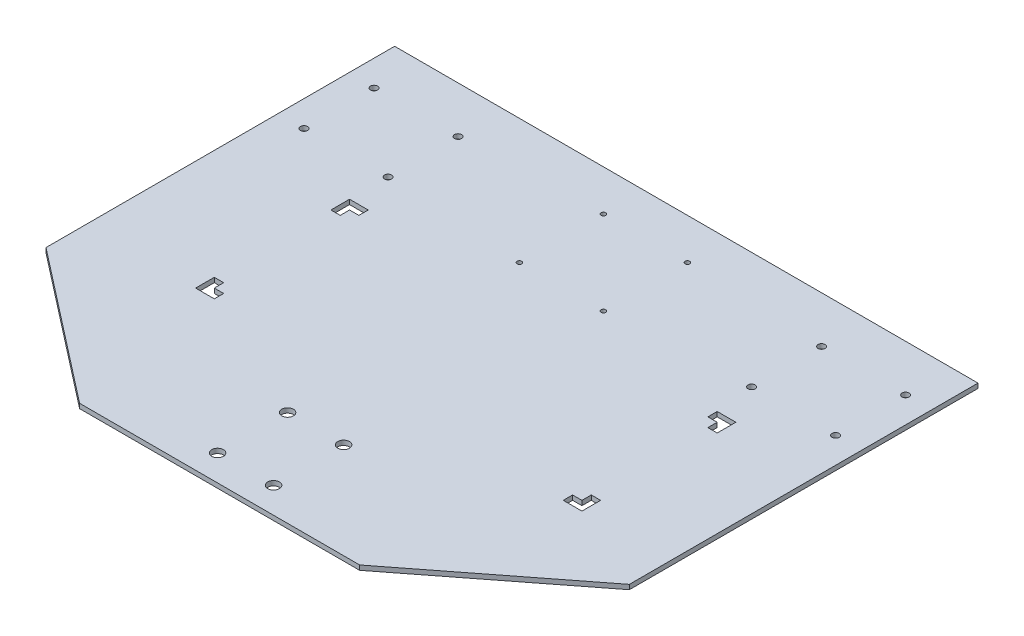
from build123d import *

# Parameters (mm, degrees)
SKETCH1_R           = 1.5
SKETCH1_R_2         = 1
SKETCH1_R_3         = 2.5
BOSS_EXTRUDE1_DEPTH = 2


with BuildPart() as part:
    # Sketch1 → Boss-Extrude1 (new body)
    with BuildSketch(Plane(origin=(0, 0, 0), x_dir=(1, 0, 0), z_dir=(0, 1, 0))):
        Polygon((-125, -50), (-60, -100.598017019), (60, -100.598017019), (125, -50), (125, 99.401982981), (-125, 99.401982981), align=None)
        with Locations(Location((-77.896249371, 49.467404951, 0), (0, 0, 270))):
            Circle(SKETCH1_R, mode=Mode.SUBTRACT)
        with Locations(Location((-77.896249371, 79.467404951, 0), (0, 0, 270))):
            Circle(SKETCH1_R, mode=Mode.SUBTRACT)
        with Locations(Location((-113.896249371, 79.467404951, 0), (0, 0, 270))):
            Circle(SKETCH1_R, mode=Mode.SUBTRACT)
        with Locations(Location((-113.896249371, 49.467404951, 0), (0, 0, 270))):
            Circle(SKETCH1_R, mode=Mode.SUBTRACT)
        with Locations(Location((113.896249371, 49.467404951, 0), (0, 0, 270))):
            Circle(SKETCH1_R, mode=Mode.SUBTRACT)
        with Locations(Location((113.896249371, 79.467404951, 0), (0, 0, 270))):
            Circle(SKETCH1_R, mode=Mode.SUBTRACT)
        with Locations(Location((77.896249371, 79.467404951, 0), (0, 0, 270))):
            Circle(SKETCH1_R, mode=Mode.SUBTRACT)
        with Locations(Location((77.896249371, 49.467404951, 0), (0, 0, 270))):
            Circle(SKETCH1_R, mode=Mode.SUBTRACT)
        with Locations(Location((-18, 81.850418852, 0), (0, 0, 270))):
            Circle(SKETCH1_R_2, mode=Mode.SUBTRACT)
        with Locations(Location((-18, 45.850418852, 0), (0, 0, 270))):
            Circle(SKETCH1_R_2, mode=Mode.SUBTRACT)
        with Locations(Location((18, 81.850418852, 0), (0, 0, 270))):
            Circle(SKETCH1_R_2, mode=Mode.SUBTRACT)
        with Locations(Location((18, 45.850418852, 0), (0, 0, 270))):
            Circle(SKETCH1_R_2, mode=Mode.SUBTRACT)
        with Locations(Location((-12, -59.472750438, 0), (0, 0, 270))):
            Circle(SKETCH1_R_3, mode=Mode.SUBTRACT)
        with Locations(Location((12, -59.472750438, 0), (0, 0, 270))):
            Circle(SKETCH1_R_3, mode=Mode.SUBTRACT)
        with Locations(Location((12, -89.472750438, 0), (0, 0, 270))):
            Circle(SKETCH1_R_3, mode=Mode.SUBTRACT)
        with Locations(Location((-12, -89.472750438, 0), (0, 0, 270))):
            Circle(SKETCH1_R_3, mode=Mode.SUBTRACT)
        Polygon((-69.896249371, 32.980170885), (-69.896249371, 28.980170885), (-73.896249371, 28.980170885), (-73.896249371, 24.980170885), (-77.896249371, 24.980170885), (-77.896249371, 32.980170885), align=None, mode=Mode.SUBTRACT)
        Polygon((-77.896249371, -24.980170885), (-77.896249371, -32.980170885), (-69.896249371, -32.980170885), (-69.896249371, -28.980170885), (-73.896249371, -28.980170885), (-73.896249371, -24.980170885), align=None, mode=Mode.SUBTRACT)
        Polygon((79.650184211, 32.980170885), (87.650184211, 32.980170885), (87.650184211, 24.980170885), (83.650184211, 24.980170885), (83.650184211, 28.980170885), (79.650184211, 28.980170885), align=None, mode=Mode.SUBTRACT)
        Polygon((83.650184211, -28.980170885), (79.650184211, -28.980170885), (79.650184211, -32.980170885), (87.650184211, -32.980170885), (87.650184211, -24.980170885), (83.650184211, -24.980170885), align=None, mode=Mode.SUBTRACT)
    extrude(amount=BOSS_EXTRUDE1_DEPTH)


solid = part.part
